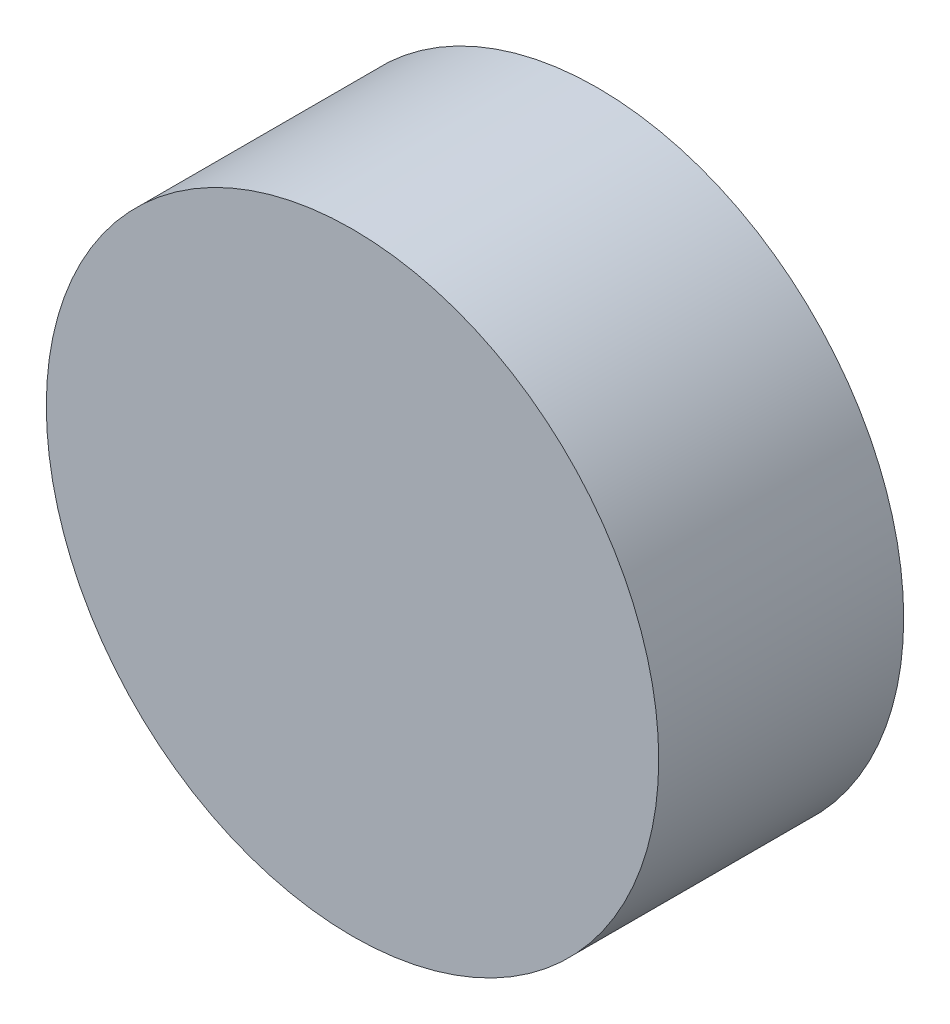
from build123d import *

# Parameters (mm, degrees)
SKETCH1_R                        = 10
OVD_QUALIFICATIONEXTRUSION_DEPTH = 8


with BuildPart() as part:
    # Sketch1 → OVD_QualificationExtrusion (new body)
    with BuildSketch(Plane.XY):
        Circle(SKETCH1_R)
    extrude(amount=OVD_QUALIFICATIONEXTRUSION_DEPTH)


solid = part.part
